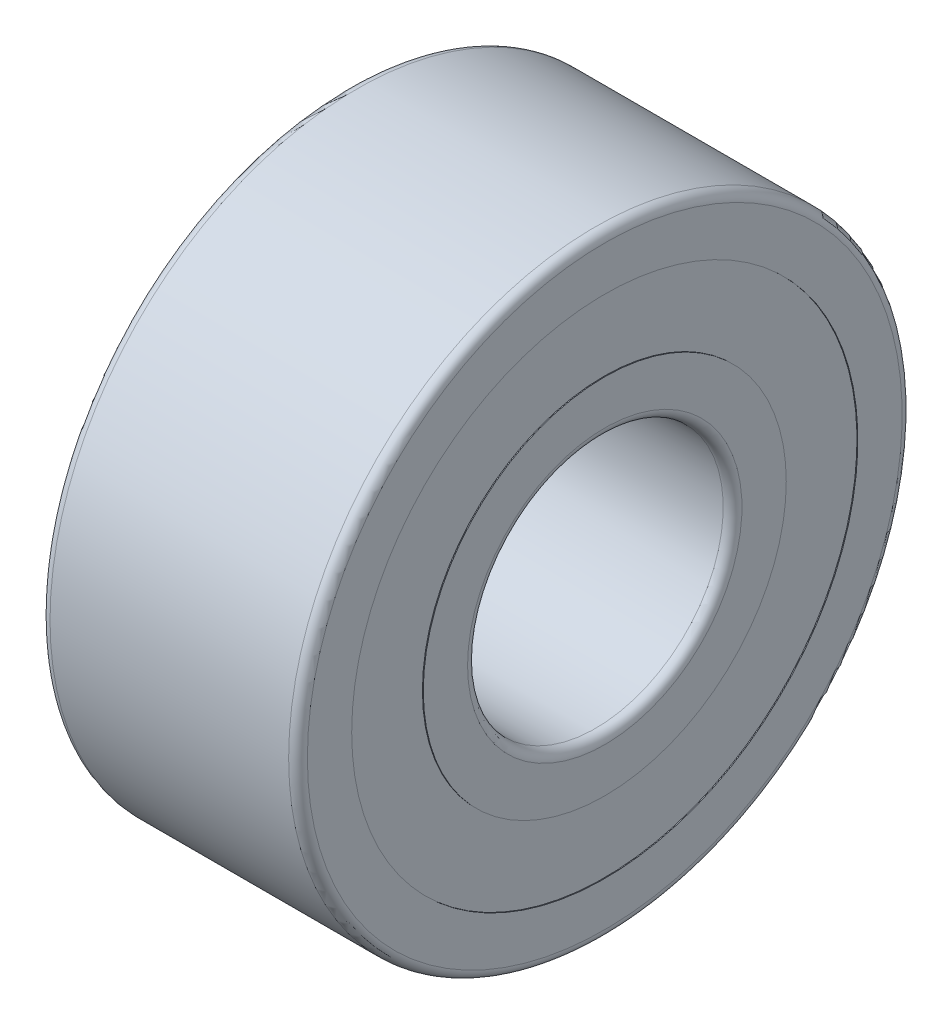
from build123d import *

# Parameters (mm, degrees)
SKETCH_2_W               = 30.2
SKETCH_2_H               = 6.3
PATTERN_CIRCULAR_2_COUNT = 10
FILLET_2_R               = 1.1
SKETCH_9_W               = 0.65
SKETCH_9_H               = 8.4


with BuildPart() as part:
    # 草图2 → Revolve 816 (revolve)
    with BuildSketch(Plane.XY, mode=Mode.PRIVATE) as revolve_816_sk:
        with Locations((15.1, 32.85)):
            Rectangle(SKETCH_2_W, SKETCH_2_H)
    revolve(revolve_816_sk.sketch.rotate(Axis((0, 0, 0), (1, 0, 0)), 90), axis=Axis((0, 0, 0), (1, 0, 0)))

    # 草图7 → 切除-旋转1 (revolve, cut)
    with BuildSketch(Plane.XY, mode=Mode.PRIVATE) as cut_revolve_1_sk:
        with BuildLine():
            Line((12.245742753, 29.7), (17.954257247, 29.7))
            ThreePointArc((17.954257247, 29.7), (28.95, 25.5), (17.954257247, 21.3))
            Line((17.954257247, 21.3), (12.245742753, 21.3))
            ThreePointArc((12.245742753, 21.3), (1.25, 25.5), (12.245742753, 29.7))
        make_face()
    revolve(cut_revolve_1_sk.sketch.rotate(Axis((0, 0, 0), (1, 0, 0)), 90), axis=Axis((0, 0, 0), (1, 0, 0)), mode=Mode.SUBTRACT)

    # 草图8 → 凸台-旋转3 (revolve)
    with BuildSketch(Plane.XY):
        with BuildLine():
            Line((1.2, 25.5), (13.9, 25.5))
            ThreePointArc((13.9, 25.5), (7.55, 31.85), (1.2, 25.5))
        make_face()
    revolve_3 = revolve(axis=Axis((0, 25.5, 0), (1, 0, 0)))

    # 草图4 → 凸台-旋转5 (revolve)
    with BuildSketch(Plane.XY, mode=Mode.PRIVATE) as revolve_5_sk:
        with BuildLine():
            Line((12.245742753, 21.3), (17.954257247, 21.3))
            ThreePointArc((17.954257247, 21.3), (22.65, 19.2), (27.345742753, 21.3))
            Line((27.345742753, 21.3), (30.2, 21.3))
            Line((30.2, 21.3), (30.2, 15))
            Line((30.2, 15), (0, 15))
            Line((0, 15), (0, 21.3))
            Line((0, 21.3), (2.854257247, 21.3))
            ThreePointArc((2.854257247, 21.3), (7.55, 19.2), (12.245742753, 21.3))
        make_face()
    revolve(revolve_5_sk.sketch.rotate(Axis((0, 0, 0), (1, 0, 0)), 90), axis=Axis((0, 0, 0), (1, 0, 0)))

    # 阵列(圆周)2: 凸台-旋转3 ×10 about axis
    pattern_circular_2_axis = Axis((0, 0, 0), (1, 0, 0))
    for i in range(1, PATTERN_CIRCULAR_2_COUNT):
        add(revolve_3.rotate(pattern_circular_2_axis, i * 360 / PATTERN_CIRCULAR_2_COUNT))

    # 镜向1: 凸台-旋转3 across plane
    add(revolve_3.mirror(Plane.ZY.offset(-15.1)))

    # 镜向1 copy 1 sketch → 镜向1 copy 1 (revolve)
    with BuildSketch(Plane(origin=(30.2, 0, 0), x_dir=(-1, 0, 0), z_dir=(0, -0.5877852522924731, 0.8090169943749475))):
        with BuildLine():
            Line((1.2, -25.5), (13.9, -25.5))
            ThreePointArc((13.9, -25.5), (7.55, -31.85), (1.2, -25.5))
        make_face()
    revolve(axis=Axis((30.2, 20.629933357, 14.988523933), (1, 0, 0)))

    # 镜向1 copy 2 sketch → 镜向1 copy 2 (revolve)
    with BuildSketch(Plane(origin=(30.2, 0, 0), x_dir=(-1, 0, 0), z_dir=(0, -0.9510565162951535, 0.30901699437494745))):
        with BuildLine():
            Line((1.2, -25.5), (13.9, -25.5))
            ThreePointArc((13.9, -25.5), (7.55, -31.85), (1.2, -25.5))
        make_face()
    revolve(axis=Axis((30.2, 7.879933357, 24.251941166), (1, 0, 0)))

    # 镜向1 copy 3 sketch → 镜向1 copy 3 (revolve)
    with BuildSketch(Plane(origin=(30.2, 0, 0), x_dir=(-1, 0, 0), z_dir=(0, -0.9510565162951536, -0.30901699437494734))):
        with BuildLine():
            Line((1.2, -25.5), (13.9, -25.5))
            ThreePointArc((13.9, -25.5), (7.55, -31.85), (1.2, -25.5))
        make_face()
    revolve(axis=Axis((30.2, -7.879933357, 24.251941166), (1, 0, 0)))

    # 镜向1 copy 4 sketch → 镜向1 copy 4 (revolve)
    with BuildSketch(Plane(origin=(30.2, 0, 0), x_dir=(-1, 0, 0), z_dir=(0, -0.5877852522924732, -0.8090169943749473))):
        with BuildLine():
            Line((1.2, -25.5), (13.9, -25.5))
            ThreePointArc((13.9, -25.5), (7.55, -31.85), (1.2, -25.5))
        make_face()
    revolve(axis=Axis((30.2, -20.629933357, 14.988523933), (1, 0, 0)))

    # 镜向1 copy 5 sketch → 镜向1 copy 5 (revolve)
    with BuildSketch(Plane(origin=(30.2, 0, 0), x_dir=(-1, 0, 0), z_dir=(0, 0, -1))):
        with BuildLine():
            Line((1.2, -25.5), (13.9, -25.5))
            ThreePointArc((13.9, -25.5), (7.55, -31.85), (1.2, -25.5))
        make_face()
    revolve(axis=Axis((30.2, -25.5, 0), (1, 0, 0)))

    # 镜向1 copy 6 sketch → 镜向1 copy 6 (revolve)
    with BuildSketch(Plane(origin=(30.2, 0, 0), x_dir=(-1, 0, 0), z_dir=(0, 0.587785252292473, -0.8090169943749476))):
        with BuildLine():
            Line((1.2, -25.5), (13.9, -25.5))
            ThreePointArc((13.9, -25.5), (7.55, -31.85), (1.2, -25.5))
        make_face()
    revolve(axis=Axis((30.2, -20.629933357, -14.988523933), (1, 0, 0)))

    # 镜向1 copy 7 sketch → 镜向1 copy 7 (revolve)
    with BuildSketch(Plane(origin=(30.2, 0, 0), x_dir=(-1, 0, 0), z_dir=(0, 0.9510565162951535, -0.30901699437494756))):
        with BuildLine():
            Line((1.2, -25.5), (13.9, -25.5))
            ThreePointArc((13.9, -25.5), (7.55, -31.85), (1.2, -25.5))
        make_face()
    revolve(axis=Axis((30.2, -7.879933357, -24.251941166), (1, 0, 0)))

    # 镜向1 copy 8 sketch → 镜向1 copy 8 (revolve)
    with BuildSketch(Plane(origin=(30.2, 0, 0), x_dir=(-1, 0, 0), z_dir=(0, 0.9510565162951536, 0.30901699437494723))):
        with BuildLine():
            Line((1.2, -25.5), (13.9, -25.5))
            ThreePointArc((13.9, -25.5), (7.55, -31.85), (1.2, -25.5))
        make_face()
    revolve(axis=Axis((30.2, 7.879933357, -24.251941166), (1, 0, 0)))

    # 镜向1 copy 9 sketch → 镜向1 copy 9 (revolve)
    with BuildSketch(Plane(origin=(30.2, 0, 0), x_dir=(-1, 0, 0), z_dir=(0, 0.5877852522924734, 0.8090169943749473))):
        with BuildLine():
            Line((1.2, -25.5), (13.9, -25.5))
            ThreePointArc((13.9, -25.5), (7.55, -31.85), (1.2, -25.5))
        make_face()
    revolve(axis=Axis((30.2, 20.629933357, -14.988523933), (1, 0, 0)))

    # 圆角2
    fillet_2_edges = [part.edges().sort_by_distance(p)[0] for p in [
        (0, 0, -15),
        (30.2, 0, -15),
        (0, 0, -36),
        (30.2, 0, -36),
    ]]
    fillet(fillet_2_edges, radius=FILLET_2_R)

    # 草图9 → 旋转1 (revolve)
    with BuildSketch(Plane.XY, mode=Mode.PRIVATE) as revolve_1_sk:
        with Locations((29.775, 25.5)):
            Rectangle(SKETCH_9_W, SKETCH_9_H)
        with Locations((0.425, 25.5)):
            Rectangle(SKETCH_9_W, SKETCH_9_H)
    revolve(revolve_1_sk.sketch.rotate(Axis((15.1, 0, 0), (-1, 0, 0)), 270), axis=Axis((15.1, 0, 0), (-1, 0, 0)))


solid = part.part
